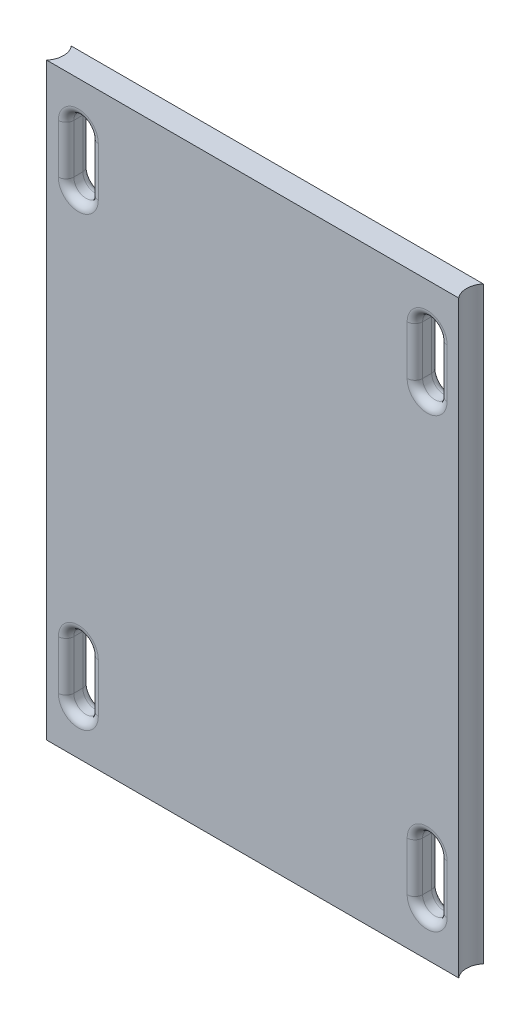
from build123d import *

# Parameters (mm, degrees)
BOSS_EXTRUDE1_DEPTH     = 76.2
CUT_EXTRUDE1_DEPTH      = 81.79080821
CUT_EXTRUDE1_DEPTH_BACK = 81.79080821
FILLET1_R               = 1


with BuildPart() as part:
    # Sketch1 → Boss-Extrude1 (new body)
    with BuildSketch(Plane(origin=(0, 0, 0), x_dir=(1, 0, 0), z_dir=(0, 1, 0))):
        with BuildLine():
            ThreePointArc((-26.0858, 0), (-26.233140847, -0.843689723), (-26.657720576, -1.5875))
            Line((-26.657720576, -1.5875), (26.657720576, -1.5875))
            ThreePointArc((26.657720576, -1.5875), (26.0858, 0), (26.657720576, 1.5875))
            Line((26.657720576, 1.5875), (-26.657720576, 1.5875))
            ThreePointArc((-26.657720576, 1.5875), (-26.233140847, 0.843689723), (-26.0858, 0))
        make_face()
    extrude(amount=BOSS_EXTRUDE1_DEPTH)

    # Sketch2 → Cut-Extrude1 (cut, two sides: drawn at the far end of the back side and taken through both)
    with BuildSketch(Plane.XY.offset(1.5875).offset(-CUT_EXTRUDE1_DEPTH_BACK)):
        with BuildLine():
            Line((-20.982720576, 70.2), (-20.982720576, 63.85))
            ThreePointArc((-20.982720576, 63.85), (-22.570220576, 62.2625), (-24.157720576, 63.85))
            Line((-24.157720576, 63.85), (-24.157720576, 70.2))
            ThreePointArc((-24.157720576, 70.2), (-22.570220576, 71.7875), (-20.982720576, 70.2))
        make_face()
        with BuildLine():
            Line((20.982720576, 70.2), (20.982720576, 63.85))
            ThreePointArc((20.982720576, 63.85), (22.570220576, 62.2625), (24.157720576, 63.85))
            Line((24.157720576, 63.85), (24.157720576, 70.2))
            ThreePointArc((24.157720576, 70.2), (22.570220576, 71.7875), (20.982720576, 70.2))
        make_face()
        with BuildLine():
            Line((20.982720576, 6), (20.982720576, 12.35))
            ThreePointArc((20.982720576, 12.35), (22.570220576, 13.9375), (24.157720576, 12.35))
            Line((24.157720576, 12.35), (24.157720576, 6))
            ThreePointArc((24.157720576, 6), (22.570220576, 4.4125), (20.982720576, 6))
        make_face()
        with BuildLine():
            Line((-20.982720576, 6), (-20.982720576, 12.35))
            ThreePointArc((-20.982720576, 12.35), (-22.570220576, 13.9375), (-24.157720576, 12.35))
            Line((-24.157720576, 12.35), (-24.157720576, 6))
            ThreePointArc((-24.157720576, 6), (-22.570220576, 4.4125), (-20.982720576, 6))
        make_face()
    extrude(amount=CUT_EXTRUDE1_DEPTH + CUT_EXTRUDE1_DEPTH_BACK, mode=Mode.SUBTRACT)

    # Fillet1
    fillet1_edges = [part.edges().sort_by_distance(p)[0] for p in [
        (-24.157720576, 67.025, 1.5875),
        (-22.570220576, 62.2625, 1.5875),
        (-20.982720576, 67.025, 1.5875),
        (-22.570220576, 71.7875, 1.5875),
        (20.982720576, 67.025, 1.5875),
        (22.570220576, 62.2625, 1.5875),
        (24.157720576, 67.025, 1.5875),
        (22.570220576, 71.7875, 1.5875),
        (24.157720576, 9.175, 1.5875),
        (22.570220576, 13.9375, 1.5875),
        (20.982720576, 9.175, 1.5875),
        (22.570220576, 4.4125, 1.5875),
        (-20.982720576, 9.175, 1.5875),
        (-22.570220576, 13.9375, 1.5875),
        (-24.157720576, 9.175, 1.5875),
        (-22.570220576, 4.4125, 1.5875),
        (-22.570220576, 4.4125, -1.5875),
        (-24.157720576, 9.175, -1.5875),
        (-22.570220576, 13.9375, -1.5875),
        (-20.982720576, 9.175, -1.5875),
        (22.570220576, 4.4125, -1.5875),
        (20.982720576, 9.175, -1.5875),
        (22.570220576, 13.9375, -1.5875),
        (24.157720576, 9.175, -1.5875),
        (22.570220576, 71.7875, -1.5875),
        (24.157720576, 67.025, -1.5875),
        (22.570220576, 62.2625, -1.5875),
        (20.982720576, 67.025, -1.5875),
        (-22.570220576, 71.7875, -1.5875),
        (-20.982720576, 67.025, -1.5875),
        (-22.570220576, 62.2625, -1.5875),
        (-24.157720576, 67.025, -1.5875),
    ]]
    fillet(fillet1_edges, radius=FILLET1_R)


solid = part.part
